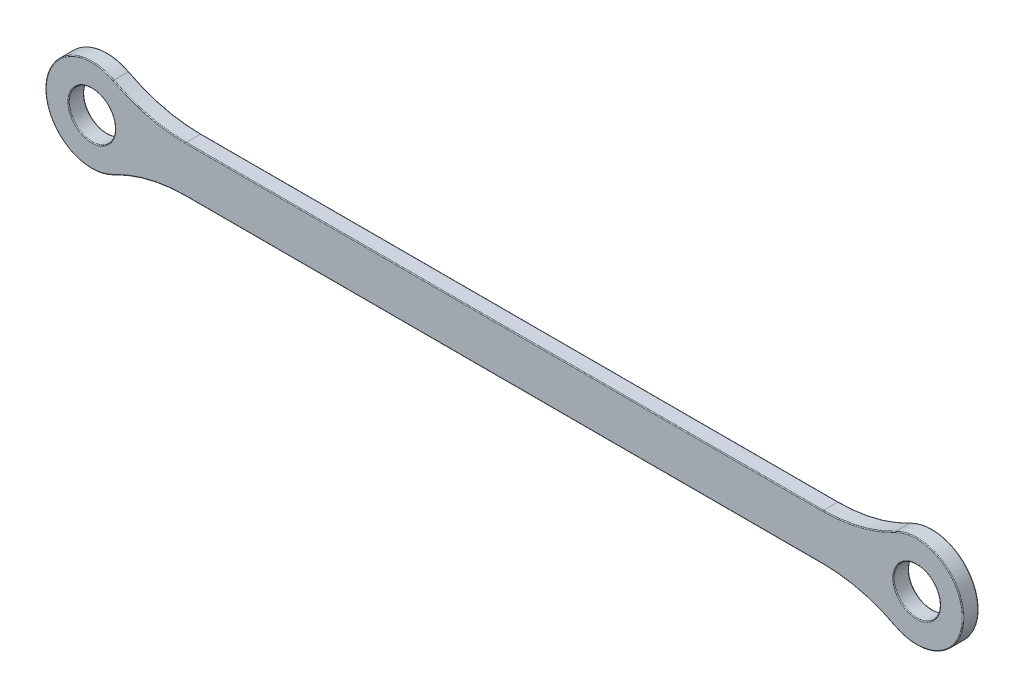
from build123d import *

# Parameters (mm, degrees)
BOSS_EXTRUDE1_DEPTH = 3
FILLET1_R           = 30
FILLET2_R           = 0.15


with BuildPart() as part:
    # Sketch1 → Boss-Extrude1 (new body)
    with BuildSketch(Plane.XY):
        with BuildLine():
            Line((-168.849894482, 152.350203209), (-24.43835175, 152.350203209))
            ThreePointArc((-24.43835175, 152.350203209), (-25.644123116, 156.850203209), (-24.43835175, 161.350203209))
            Line((-24.43835175, 161.350203209), (-168.849894482, 161.350203209))
            ThreePointArc((-168.849894482, 161.350203209), (-167.950790679, 159.179574615), (-167.644123116, 156.850203209))
            ThreePointArc((-167.644123116, 156.850203209), (-167.950790679, 154.520831804), (-168.849894482, 152.350203209))
        make_face()
        with BuildLine():
            ThreePointArc((-168.849894482, 161.350203209), (-185.644123116, 156.850203209), (-168.849894482, 152.350203209))
            Line((-168.849894482, 152.350203209), (-176.644123116, 152.350203209))
            ThreePointArc((-176.644123116, 152.350203209), (-181.144123116, 156.850203209), (-176.644123116, 161.350203209))
            Line((-176.644123116, 161.350203209), (-168.849894482, 161.350203209))
        make_face()
        with BuildLine():
            ThreePointArc((-16.644123116, 161.350203209), (-12.144123116, 156.850203209), (-16.644123116, 152.350203209))
            Line((-16.644123116, 152.350203209), (-24.43835175, 152.350203209))
            ThreePointArc((-24.43835175, 152.350203209), (-14.31475171, 148.156870773), (-7.644123116, 156.850203209))
            ThreePointArc((-7.644123116, 156.850203209), (-14.31475171, 165.543535646), (-24.43835175, 161.350203209))
            Line((-24.43835175, 161.350203209), (-16.644123116, 161.350203209))
        make_face()
        with BuildLine():
            Line((-24.43835175, 152.350203209), (-16.644123116, 152.350203209))
            ThreePointArc((-16.644123116, 152.350203209), (-21.144123116, 156.850203209), (-16.644123116, 161.350203209))
            Line((-16.644123116, 161.350203209), (-24.43835175, 161.350203209))
            ThreePointArc((-24.43835175, 161.350203209), (-25.644123116, 156.850203209), (-24.43835175, 152.350203209))
        make_face()
        with BuildLine():
            Line((-176.644123116, 152.350203209), (-168.849894482, 152.350203209))
            ThreePointArc((-168.849894482, 152.350203209), (-167.950790679, 154.520831804), (-167.644123116, 156.850203209))
            ThreePointArc((-167.644123116, 156.850203209), (-167.950790679, 159.179574615), (-168.849894482, 161.350203209))
            Line((-168.849894482, 161.350203209), (-176.644123116, 161.350203209))
            ThreePointArc((-176.644123116, 161.350203209), (-172.144123116, 156.850203209), (-176.644123116, 152.350203209))
        make_face()
    extrude(amount=BOSS_EXTRUDE1_DEPTH)

    # Fillet1
    fillet1_edges = [part.edges().sort_by_distance(p)[0] for p in [
        (-24.43835175, 152.350203209, 1.5),
        (-168.849894482, 152.350203209, 1.5),
        (-168.849894482, 161.350203209, 1.5),
        (-24.43835175, 161.350203209, 1.5),
    ]]
    fillet(fillet1_edges, radius=FILLET1_R)

    # Fillet2
    fillet2_edges = [part.edges().sort_by_distance(p)[0] for p in [
        (-176.644123116, 161.350203209, 3),
        (-96.644123116, 161.350203209, 0),
        (-96.644123116, 161.350203209, 3),
        (-7.644123116, 156.850203209, 0),
        (-7.644123116, 156.850203209, 3),
        (-96.644123116, 152.350203209, 0),
        (-96.644123116, 152.350203209, 3),
        (-16.644123116, 152.350203209, 3),
        (-185.644123116, 156.850203209, 0),
        (-185.644123116, 156.850203209, 3),
        (-27.624889674, 162.228442908, 0),
        (-27.624889674, 162.228442908, 3),
        (-27.624889674, 151.471963511, 0),
        (-27.624889674, 151.471963511, 3),
        (-165.663356558, 151.471963511, 0),
        (-165.663356558, 151.471963511, 3),
        (-165.663356558, 162.228442908, 0),
        (-165.663356558, 162.228442908, 3),
        (-16.644123116, 152.350203209, 0),
        (-176.644123116, 161.350203209, 0),
    ]]
    fillet(fillet2_edges, radius=FILLET2_R)


solid = part.part
